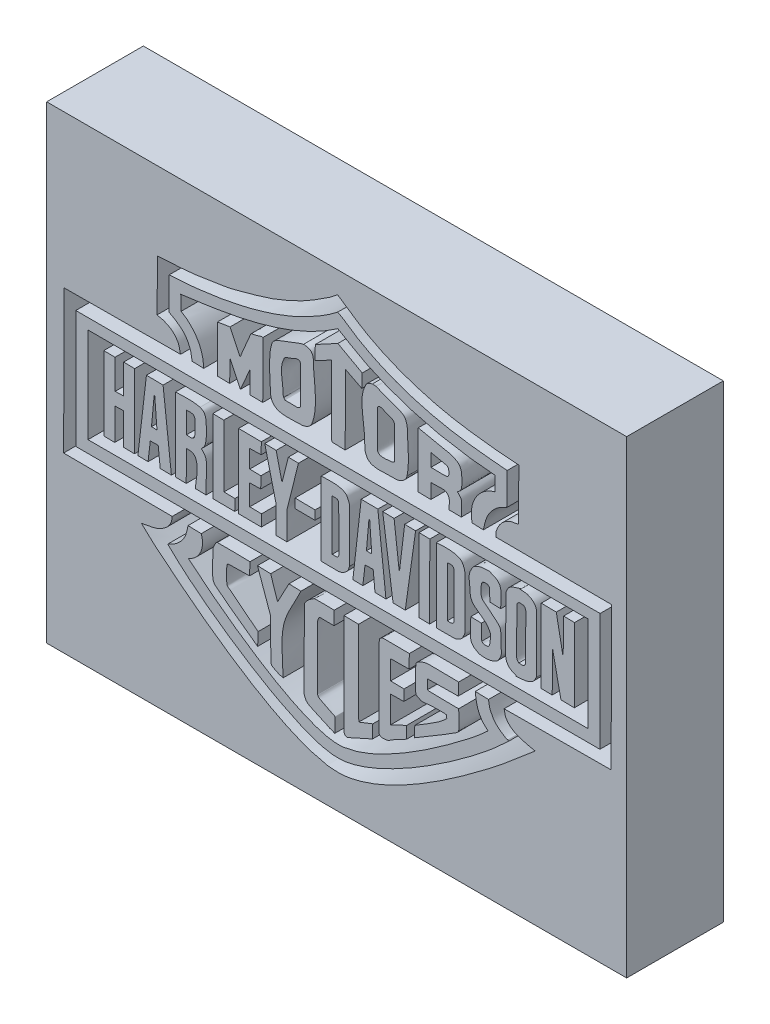
from build123d import *

# Parameters (mm, degrees)
SKETCH1_W              = 120
SKETCH1_H              = 97
BOSS_EXTRUDE2_DEPTH    = 20
BOSS_EXTRUDE2_2_DEPTH  = 20
BOSS_EXTRUDE2_3_DEPTH  = 20
BOSS_EXTRUDE2_4_DEPTH  = 20
BOSS_EXTRUDE2_5_DEPTH  = 20
BOSS_EXTRUDE2_6_DEPTH  = 20
BOSS_EXTRUDE2_7_DEPTH  = 20
BOSS_EXTRUDE2_8_DEPTH  = 20
BOSS_EXTRUDE2_9_DEPTH  = 20
BOSS_EXTRUDE2_10_DEPTH = 20
BOSS_EXTRUDE2_11_DEPTH = 20
BOSS_EXTRUDE2_12_DEPTH = 20
BOSS_EXTRUDE2_13_DEPTH = 20
BOSS_EXTRUDE2_14_DEPTH = 20
BOSS_EXTRUDE2_15_DEPTH = 20
BOSS_EXTRUDE2_16_DEPTH = 20
BOSS_EXTRUDE2_17_DEPTH = 20
BOSS_EXTRUDE2_18_DEPTH = 20
BOSS_EXTRUDE2_19_DEPTH = 20
BOSS_EXTRUDE2_20_DEPTH = 20
BOSS_EXTRUDE2_21_DEPTH = 20
BOSS_EXTRUDE2_22_DEPTH = 20
BOSS_EXTRUDE2_23_DEPTH = 20
BOSS_EXTRUDE2_24_DEPTH = 20
BOSS_EXTRUDE2_25_DEPTH = 20
BOSS_EXTRUDE2_26_DEPTH = 20
BOSS_EXTRUDE2_27_DEPTH = 20
BOSS_EXTRUDE2_28_DEPTH = 20
BOSS_EXTRUDE2_29_DEPTH = 20
BOSS_EXTRUDE2_30_DEPTH = 20


with BuildPart() as part:
    # Sketch1 → Boss-Extrude2 (new body)
    with BuildSketch(Plane.XY):
        with Locations((60, 48.5)):
            Rectangle(SKETCH1_W, SKETCH1_H)
        with BuildLine():
            Line((22.821847687, 70.218295714), (22.947847687, 80.844295714))
            add(Edge.make_bspline(
                [(22.947847687, 80.844295714), (25.958713345, 81.085733055), (29.004754552, 81.067077924), (31.977847687, 81.600295714), (34.553847687, 82.062295714), (37.197481362, 82.239758118), (39.705847687, 82.986295714), (42.015437995, 83.673673782), (44.368205474, 84.229130213), (46.635847687, 85.044295714), (48.659856628, 85.771880628), (50.641334523, 86.630094252), (52.557847687, 87.606295714), (54.387071023, 88.538034941), (56.123033864, 89.646201114), (57.849847687, 90.756295714), (58.674202593, 91.286238154), (59.417847687, 91.932295714), (60.201847687, 92.520295714)],
                knots=[0, 0, 0, 0, 1, 1, 1, 2, 2, 2, 3, 3, 3, 4, 4, 4, 5, 5, 5, 6, 6, 6, 6], degree=3))
            add(Edge.make_bspline(
                [(60.201847687, 92.520295714), (62.091847687, 91.274295714), (63.913753165, 89.918289483), (65.871847687, 88.782295714), (67.588599224, 87.786317723), (69.378432772, 86.91073921), (71.205847687, 86.136295714), (73.150735574, 85.312068133), (75.145498466, 84.597578594), (77.169847687, 83.994295714), (79.379400857, 83.335819604), (81.624352313, 82.784368968), (83.889847687, 82.356295714), (86.446202878, 81.873263483), (89.033439072, 81.562798837), (91.617847687, 81.264295714), (93.641334998, 81.030579854), (95.677847687, 80.928295714), (97.707847687, 80.760295714)],
                knots=[0, 0, 0, 0, 1, 1, 1, 2, 2, 2, 3, 3, 3, 4, 4, 4, 5, 5, 5, 6, 6, 6, 6], degree=3))
            Line((97.707847687, 80.760295714), (97.581847687, 70.092295714))
            add(Edge.make_bspline(
                [(97.581847687, 70.092295714), (96.951847687, 69.952295714), (96.279847687, 69.938295714), (95.691847687, 69.672295714), (95.079450307, 69.395258804), (94.499957374, 68.999054251), (94.053847687, 68.496295714), (93.596272926, 67.980616222), (93.287919226, 67.335819819), (93.045847687, 66.690295714), (92.902530814, 66.308117387), (92.961847687, 65.878295714), (92.919847687, 65.472295714)],
                knots=[0, 0, 0, 0, 1, 1, 1, 2, 2, 2, 3, 3, 3, 4, 4, 4, 4], degree=3))
            Line((92.919847687, 65.472295714), (116.901847687, 65.346295714))
            Line((116.901847687, 65.346295714), (116.775847687, 35.694295714))
            Line((116.775847687, 35.694295714), (94.641847687, 35.568295714))
            add(Edge.make_bspline(
                [(94.641847687, 35.568295714), (94.767847687, 35.092295714), (94.774160512, 34.567015543), (95.019847687, 34.140295714), (95.321521111, 33.616336608), (95.738569205, 33.137266384), (96.237847687, 32.796295714), (97.638091572, 31.840031597), (99.413871331, 31.573774246), (101.067847687, 31.200295714)],
                knots=[0, 0, 0, 0, 1, 1, 1, 2, 2, 2, 3, 3, 3, 3], degree=3))
            add(Edge.make_bspline(
                [(101.067847687, 31.200295714), (98.449847687, 29.002295714), (95.900603159, 26.719698902), (93.213847687, 24.606295714), (90.255995966, 22.279648083), (87.231767286, 20.034451405), (84.141847687, 17.886295714), (81.670629469, 16.168269951), (79.13564206, 14.537576244), (76.539847687, 13.014295714), (74.455149856, 11.790940101), (72.308989736, 10.666182755), (70.113847687, 9.654295714), (68.536467241, 8.927176103), (66.904840593, 8.307580657), (65.241847687, 7.806295714), (63.969501581, 7.422765548), (62.65889502, 7.132817816), (61.335847687, 7.008295714), (60.261776459, 6.907206657), (59.179319559, 7.08042212), (58.101847687, 7.134295714), (58.057631036, 7.136506547), (58.018645552, 7.164966868), (57.975847687, 7.176295714), (56.590558083, 7.542990021), (55.164239193, 7.777661521), (53.817847687, 8.268295714), (51.850522391, 8.98520239), (49.9267614, 9.832326835), (48.063847687, 10.788295714), (45.664541506, 12.019518623), (43.324254918, 13.371278204), (41.049847687, 14.820295714), (38.112073698, 16.691942046), (35.238901194, 18.668922746), (32.439847687, 20.742295714), (29.187701719, 23.151292727), (26.035005632, 25.693568118), (22.905847687, 28.260295714), (21.748855601, 29.209331706), (20.693847687, 30.276295714), (19.587847687, 31.284295714)],
                knots=[0, 0, 0, 0, 1, 1, 1, 2, 2, 2, 3, 3, 3, 4, 4, 4, 5, 5, 5, 6, 6, 6, 7, 7, 7, 8, 8, 8, 9, 9, 9, 10, 10, 10, 11, 11, 11, 12, 12, 12, 13, 13, 13, 14, 14, 14, 14], degree=3))
            add(Edge.make_bspline(
                [(19.587847687, 31.284295714), (20.637847687, 31.508295714), (21.725274203, 31.59940506), (22.737847687, 31.956295714), (23.45354083, 32.208548215), (24.128212435, 32.60530304), (24.711847687, 33.090295714), (25.14254842, 33.448201957), (25.475933567, 33.930206533), (25.719847687, 34.434295714), (25.906406115, 34.819849799), (25.887847687, 35.274295714), (25.971847687, 35.694295714)],
                knots=[0, 0, 0, 0, 1, 1, 1, 2, 2, 2, 3, 3, 3, 4, 4, 4, 4], degree=3))
            Line((25.971847687, 35.694295714), (3.501847687, 35.820295714))
            Line((3.501847687, 35.820295714), (3.627847687, 65.472295714))
            Line((3.627847687, 65.472295714), (27.693847687, 65.598295714))
            add(Edge.make_bspline(
                [(27.693847687, 65.598295714), (27.525847687, 66.214295714), (27.481060853, 66.878074902), (27.189847687, 67.446295714), (26.894671308, 68.022249623), (26.470196218, 68.54537836), (25.971847687, 68.958295714), (25.470244979, 69.373909386), (24.85467026, 69.640366685), (24.249847687, 69.882295714), (23.795823534, 70.063905375), (23.297847687, 70.106295714), (22.821847687, 70.218295714)],
                knots=[0, 0, 0, 0, 1, 1, 1, 2, 2, 2, 3, 3, 3, 4, 4, 4, 4], degree=3))
        make_face(mode=Mode.SUBTRACT)
    extrude(amount=BOSS_EXTRUDE2_DEPTH)


with BuildPart() as body_2:
    # Sketch1 → Boss-Extrude2 2 (new body)
    with BuildSketch(Plane.XY):
        with BuildLine():
            add(Edge.make_bspline(
                [(53.145847687, 80.130295714), (53.783091445, 80.092810787), (54.484230936, 80.030082516), (54.867847687, 79.416295714), (55.05436965, 79.117860573), (55.160542041, 78.852653917), (55.161847687, 78.492295714), (55.17529001, 74.782214407), (56.251086111, 70.882010987), (55.077847687, 67.362295714), (54.832999919, 66.627752412), (54.707587516, 66.212628565), (53.943847687, 65.808295714), (53.600926611, 65.626749262), (53.123015069, 65.472295714), (52.725847687, 65.472295714), (50.059155958, 65.472295714), (46.317896569, 64.586274897), (46.299847687, 68.286295714)],
                knots=[0, 0, 0, 0, 1, 1, 1, 2, 2, 2, 3, 3, 3, 4, 4, 4, 5, 5, 5, 6, 6, 6, 6], degree=3))
            add(Edge.make_bspline(
                [(46.299847687, 68.286295714), (46.290439131, 70.215049676), (45.715482787, 74.345201016), (46.593847687, 76.980295714), (46.876360602, 77.827834459), (47.828708242, 78.167683573), (48.567847687, 78.450295714), (49.66066626, 78.86813811), (50.751855085, 79.29029856), (51.843847687, 79.710295714), (52.108431, 79.812058527), (52.366833249, 79.935542105), (52.641847687, 80.004295714), (53.182684124, 80.139504823), (52.914383667, 80.014563704), (53.145847687, 80.130295714)],
                knots=[6, 6, 6, 6, 7, 7, 7, 8, 8, 8, 9, 9, 9, 10, 10, 10, 11, 11, 11, 11], degree=3))
        make_face()
        with BuildLine():
            add(Edge.make_bspline(
                [(49.029847687, 68.538295714), (48.963046165, 68.664476365), (48.946734456, 68.815525922), (48.945847687, 68.958295714), (48.932629406, 71.086438866), (48.078094778, 73.438789896), (49.029847687, 75.342295714), (49.077529969, 75.437660278), (49.090839823, 75.551785492), (49.155847687, 75.636295714), (49.234545263, 75.738602564), (49.341273734, 75.818498173), (49.449847687, 75.888295714), (49.703521231, 76.051371564), (50.009161676, 76.11402621), (50.289847687, 76.224295714), (50.797063987, 76.423559261), (51.314195706, 76.610469723), (51.801847687, 76.854295714)],
                knots=[6, 6, 6, 6, 7, 7, 7, 8, 8, 8, 9, 9, 9, 10, 10, 10, 11, 11, 11, 12, 12, 12, 12], degree=3))
            add(Edge.make_bspline(
                [(51.801847687, 76.854295714), (52.239984771, 76.810482006), (52.515847687, 76.764847312), (52.515847687, 76.224295714), (52.515847687, 73.69025704), (52.501692584, 71.156181398), (52.473847687, 68.622295714), (52.470568744, 68.323911972), (51.926873404, 68.16346277), (51.717847687, 68.160295714), (50.933812686, 68.148416396), (50.149490435, 68.174799477), (49.365847687, 68.202295714), (49.346060873, 68.202989988), (49.337847687, 68.230295714), (49.323847687, 68.244295714), (49.225847687, 68.342295714), (49.094693616, 68.415808958), (49.029847687, 68.538295714)],
                knots=[0, 0, 0, 0, 1, 1, 1, 2, 2, 2, 3, 3, 3, 4, 4, 4, 5, 5, 5, 6, 6, 6, 6], degree=3))
        make_face(mode=Mode.SUBTRACT)
    extrude(amount=BOSS_EXTRUDE2_2_DEPTH)


with BuildPart() as body_3:
    # Sketch1 → Boss-Extrude2 3 (new body)
    with BuildSketch(Plane.XY):
        Polygon((55.581847687, 81.306295714), (60.243847687, 83.826295714), (65.283847687, 81.054295714), (65.199847687, 78.240295714), (61.839847687, 79.962295714), (61.755847687, 65.472295714), (58.983847687, 65.556295714), (58.899847687, 80.172295714), (55.497847687, 78.366295714), align=None)
    extrude(amount=BOSS_EXTRUDE2_3_DEPTH)


with BuildPart() as body_4:
    # Sketch1 → Boss-Extrude2 4 (new body)
    with BuildSketch(Plane.XY):
        with BuildLine():
            add(Edge.make_bspline(
                [(67.383847687, 80.130295714), (67.635847687, 80.116295714), (67.888845858, 80.114716959), (68.139847687, 80.088295714), (68.15953789, 80.086223061), (68.163064716, 80.052556704), (68.181847687, 80.046295714), (68.90889186, 79.803947656), (69.613608485, 79.521464638), (70.323847687, 79.248295714), (71.054389264, 78.967318185), (71.782060152, 78.68046604), (72.507847687, 78.408295714), (73.190831832, 78.15217666), (73.950585981, 77.89790636), (74.271847687, 77.148295714), (74.448409681, 76.736317727), (74.599431918, 76.294435396), (74.607847687, 75.846295714), (74.659369119, 73.102779441), (75.145990362, 70.305009088), (74.607847687, 67.614295714), (74.582984987, 67.489982215), (74.590710387, 67.360609214), (74.565847687, 67.236295714)],
                knots=[0, 0, 0, 0, 1, 1, 1, 2, 2, 2, 3, 3, 3, 4, 4, 4, 5, 5, 5, 6, 6, 6, 7, 7, 7, 8, 8, 8, 8], degree=3))
            add(Edge.make_bspline(
                [(74.565847687, 67.236295714), (74.378712654, 66.30062055), (73.352916389, 65.570039836), (72.423847687, 65.514295714), (71.864678315, 65.480745552), (71.304022659, 65.472295714), (70.743847687, 65.472295714), (69.680912458, 65.472295714), (67.060251511, 65.039577804), (66.249847687, 66.480295714), (66.020564867, 66.887909615), (65.857115007, 67.267662157), (65.829847687, 67.740295714), (65.797583549, 68.299540764), (65.787847687, 68.860120741), (65.787847687, 69.420295714), (65.787847687, 72.59841906), (64.450547718, 76.111695777), (65.871847687, 78.954295714), (66.057636251, 79.325872843), (66.067708088, 79.512726515), (66.417847687, 79.752295714), (66.748074319, 79.978240252), (67.02936295, 80.012134135), (67.383847687, 80.130295714)],
                knots=[8, 8, 8, 8, 9, 9, 9, 10, 10, 10, 11, 11, 11, 12, 12, 12, 13, 13, 13, 14, 14, 14, 15, 15, 15, 16, 16, 16, 16], degree=3))
        make_face()
        with BuildLine():
            add(Edge.make_bspline(
                [(71.961847687, 68.580295714), (71.960780676, 68.498669361), (71.899592605, 68.421291649), (71.835847687, 68.370295714), (71.693277913, 68.256239895), (71.440016967, 68.160295714), (71.247847687, 68.160295714), (70.547106077, 68.160295714), (68.433847687, 67.616013913), (68.433847687, 69.000295714), (68.433847687, 71.50633482), (68.448004526, 74.012411288), (68.475847687, 76.518295714), (68.476690873, 76.594182503), (68.739244915, 76.796994328), (68.853847687, 76.854295714)],
                knots=[5, 5, 5, 5, 6, 6, 6, 7, 7, 7, 8, 8, 8, 9, 9, 9, 10, 10, 10, 10], degree=3))
            add(Edge.make_bspline(
                [(68.853847687, 76.854295714), (69.009595643, 76.838720918), (69.171112671, 76.829892485), (69.315847687, 76.770295714), (69.537060375, 76.679208137), (69.764747458, 76.604657093), (69.987847687, 76.518295714), (70.198773069, 76.436647179), (70.407847687, 76.350295714), (70.617847687, 76.266295714), (71.278077078, 76.002203958), (71.998554013, 75.821870804), (72.003847687, 74.964295714), (72.016983523, 72.836290204), (71.989662906, 70.708159975), (71.961847687, 68.580295714)],
                knots=[0, 0, 0, 0, 1, 1, 1, 2, 2, 2, 3, 3, 3, 4, 4, 4, 5, 5, 5, 5], degree=3))
        make_face(mode=Mode.SUBTRACT)
    extrude(amount=BOSS_EXTRUDE2_4_DEPTH)


with BuildPart() as body_5:
    # Sketch1 → Boss-Extrude2 5 (new body)
    with BuildSketch(Plane.XY):
        with BuildLine():
            add(Edge.make_bspline(
                [(83.217847687, 65.514295714), (83.205564835, 66.202135428), (83.638345602, 67.687422277), (82.839847687, 68.286295714), (82.630478141, 68.443322873), (82.310391466, 68.580295714), (82.041847687, 68.580295714), (81.201731028, 68.580295714), (80.361847687, 68.552295714), (79.521847687, 68.538295714)],
                knots=[0, 0, 0, 0, 1, 1, 1, 2, 2, 2, 3, 3, 3, 3], degree=3))
            Line((79.521847687, 68.538295714), (79.479847687, 65.472295714))
            Line((79.479847687, 65.472295714), (76.875847687, 65.514295714))
            Line((76.875847687, 65.514295714), (76.875847687, 77.022295714))
            add(Edge.make_bspline(
                [(76.875847687, 77.022295714), (78.435052729, 76.729944769), (79.959716938, 76.376322953), (81.495847687, 76.056295714), (82.342206683, 75.879970923), (83.225236346, 75.797717106), (84.015847687, 75.468295714), (84.570942719, 75.237006117), (85.16441518, 74.980802601), (85.485847687, 74.418295714), (85.648448094, 74.133745002), (85.813952831, 73.821932207), (85.821847687, 73.494295714), (85.8263431, 73.307736083), (86.196566007, 70.802603824), (85.527847687, 70.050295714), (85.375298407, 69.878677774), (85.168694784, 69.763757927), (84.981847687, 69.630295714)],
                knots=[0, 0, 0, 0, 1, 1, 1, 2, 2, 2, 3, 3, 3, 4, 4, 4, 5, 5, 5, 6, 6, 6, 6], degree=3))
            add(Edge.make_bspline(
                [(84.981847687, 69.630295714), (85.284196724, 69.327946676), (85.809543416, 68.850162273), (85.821847687, 68.370295714), (85.846611379, 67.404511701), (85.793847687, 66.438295714), (85.779847687, 65.472295714)],
                knots=[0, 0, 0, 0, 1, 1, 1, 2, 2, 2, 2], degree=3))
            Line((85.779847687, 65.472295714), (83.217847687, 65.514295714))
        make_face()
        with BuildLine():
            Line((79.521847687, 71.268295714), (79.521847687, 73.914295714))
            add(Edge.make_bspline(
                [(79.521847687, 73.914295714), (80.670421558, 73.68458094), (81.691346579, 73.482839433), (82.797847687, 73.242295714), (82.817194792, 73.238089822), (82.825847687, 73.214295714), (82.839847687, 73.200295714), (82.923847687, 73.116295714), (83.032909388, 73.051437737), (83.091847687, 72.948295714), (83.219713996, 72.724529673), (83.312341402, 71.740789429), (83.091847687, 71.520295714), (83.007847687, 71.436295714), (82.957289613, 71.286167312), (82.839847687, 71.268295714), (82.286048157, 71.184021873), (81.720022659, 71.226295714), (81.159847687, 71.226295714), (80.613668229, 71.226295714), (80.067847687, 71.254295714), (79.521847687, 71.268295714)],
                knots=[0, 0, 0, 0, 1, 1, 1, 2, 2, 2, 3, 3, 3, 4, 4, 4, 5, 5, 5, 6, 6, 6, 7, 7, 7, 7], degree=3))
        make_face(mode=Mode.SUBTRACT)
    extrude(amount=BOSS_EXTRUDE2_5_DEPTH)


with BuildPart() as body_6:
    # Sketch1 → Boss-Extrude2 6 (new body)
    with BuildSketch(Plane.XY):
        Polygon((11.817847687, 43.044295714), (11.817847687, 58.332295714), (14.127847687, 58.290295714), (14.169847687, 52.200295714), (15.891847687, 52.242295714), (15.933847687, 58.332295714), (18.201847687, 58.290295714), (18.159847687, 43.002295714), (15.891847687, 43.044295714), (15.849847687, 49.596295714), (14.127847687, 49.554295714), (14.085847687, 43.002295714), align=None)
    extrude(amount=BOSS_EXTRUDE2_6_DEPTH)


with BuildPart() as body_7:
    # Sketch1 → Boss-Extrude2 7 (new body)
    with BuildSketch(Plane.XY):
        Polygon((18.873847687, 43.044295714), (20.637847687, 58.332295714), (24.081847687, 58.290295714), (25.803847687, 43.002295714), (23.493847687, 43.044295714), (23.073847687, 46.992295714), (21.435847687, 46.950295714), (20.973847687, 43.002295714), align=None)
        Polygon((22.821847687, 49.596295714), (21.687847687, 49.638295714), (22.233847687, 55.518295714), (22.359847687, 55.476295714), align=None, mode=Mode.SUBTRACT)
    extrude(amount=BOSS_EXTRUDE2_7_DEPTH)


with BuildPart() as body_8:
    # Sketch1 → Boss-Extrude2 8 (new body)
    with BuildSketch(Plane.XY):
        with BuildLine():
            add(Edge.make_bspline(
                [(47.475847687, 43.044295714), (47.461847687, 45.004295714), (47.461647018, 46.964442863), (47.433847687, 48.924295714), (47.433566878, 48.944092713), (47.396580022, 48.9470706), (47.391847687, 48.966295714), (47.171883144, 49.859901668), (46.975373591, 50.759129423), (46.761847687, 51.654295714), (46.230119724, 53.883462944), (45.679667137, 56.109017913), (45.123847687, 58.332295714)],
                knots=[0, 0, 0, 0, 1, 1, 1, 2, 2, 2, 3, 3, 3, 4, 4, 4, 4], degree=3))
            Line((45.123847687, 58.332295714), (47.475847687, 58.290295714))
            Line((47.475847687, 58.290295714), (48.693847687, 53.124295714))
            Line((48.693847687, 53.124295714), (49.995847687, 58.332295714))
            Line((49.995847687, 58.332295714), (52.095847687, 58.290295714))
            add(Edge.make_bspline(
                [(52.095847687, 58.290295714), (51.765244255, 56.857680842), (51.398578168, 55.43362371), (51.045847687, 54.006295714), (50.751771857, 52.816314451), (50.456695362, 51.626579814), (50.163847687, 50.436295714), (50.02269494, 49.862578099), (49.780495018, 49.303984592), (49.743847687, 48.714295714), (49.625744656, 46.813910576), (49.715847687, 44.906295714), (49.701847687, 43.002295714)],
                knots=[0, 0, 0, 0, 1, 1, 1, 2, 2, 2, 3, 3, 3, 4, 4, 4, 4], degree=3))
            Line((49.701847687, 43.002295714), (47.475847687, 43.044295714))
        make_face()
    extrude(amount=BOSS_EXTRUDE2_8_DEPTH)


with BuildPart() as body_9:
    # Sketch1 → Boss-Extrude2 9 (new body)
    with BuildSketch(Plane.XY):
        Polygon((6.021847687, 38.256295714), (6.021847687, 62.616295714), (114.507847687, 62.574295714), (114.465847687, 38.214295714), align=None)
        Polygon((111.987847687, 40.692295714), (8.541847687, 40.734295714), (8.541847687, 60.390295714), (112.029847687, 60.348295714), align=None, mode=Mode.SUBTRACT)
    extrude(amount=BOSS_EXTRUDE2_9_DEPTH)


with BuildPart() as body_10:
    # Sketch1 → Boss-Extrude2 10 (new body)
    with BuildSketch(Plane.XY):
        with BuildLine():
            add(Edge.make_bspline(
                [(56.799847687, 58.332295714), (57.518421445, 58.323741265), (61.342946302, 58.823518207), (62.175847687, 57.324295714), (62.434466107, 56.858782558), (62.677713308, 56.278965431), (62.679847687, 55.728295714), (62.693522003, 52.200322215), (62.693792242, 48.672268156), (62.679847687, 45.144295714), (62.67976943, 45.124496879), (62.644108677, 45.121078685), (62.637847687, 45.102295714), (62.573386846, 44.908913192), (62.534308528, 44.707678237), (62.469847687, 44.514295714), (62.206213789, 43.723394022), (61.090147415, 43.044295714), (60.285847687, 43.044295714), (59.123763352, 43.044295714), (57.961847687, 43.072295714), (56.799847687, 43.086295714)],
                knots=[0, 0, 0, 0, 1, 1, 1, 2, 2, 2, 3, 3, 3, 4, 4, 4, 5, 5, 5, 6, 6, 6, 7, 7, 7, 7], degree=3))
            Line((56.799847687, 43.086295714), (56.799847687, 58.332295714))
        make_face()
        with BuildLine():
            Line((59.067847687, 45.438295714), (59.067847687, 55.938295714))
            add(Edge.make_bspline(
                [(59.067847687, 55.938295714), (59.095187593, 55.937052991), (60.075968611, 55.975481251), (60.243847687, 55.770295714), (60.331161052, 55.663579379), (60.408863883, 55.530147435), (60.411847687, 55.392295714), (60.479105343, 52.284991994), (60.453847687, 49.176327245), (60.453847687, 46.068295714), (60.453847687, 45.910365163), (60.281630675, 45.496758353), (60.075847687, 45.480295714), (59.740627141, 45.45347807), (59.403847687, 45.452295714), (59.067847687, 45.438295714)],
                knots=[0, 0, 0, 0, 1, 1, 1, 2, 2, 2, 3, 3, 3, 4, 4, 4, 5, 5, 5, 5], degree=3))
        make_face(mode=Mode.SUBTRACT)
    extrude(amount=BOSS_EXTRUDE2_10_DEPTH)


with BuildPart() as body_11:
    # Sketch1 → Boss-Extrude2 11 (new body)
    with BuildSketch(Plane.XY):
        Polygon((63.351847687, 43.044295714), (65.073847687, 58.332295714), (68.517847687, 58.290295714), (70.197847687, 43.002295714), (67.929847687, 43.044295714), (67.551847687, 46.992295714), (65.871847687, 46.950295714), (65.409847687, 43.002295714), align=None)
        Polygon((67.257847687, 49.596295714), (66.165847687, 49.638295714), (66.669847687, 55.518295714), (66.837847687, 55.476295714), align=None, mode=Mode.SUBTRACT)
    extrude(amount=BOSS_EXTRUDE2_11_DEPTH)


with BuildPart() as body_12:
    # Sketch1 → Boss-Extrude2 12 (new body)
    with BuildSketch(Plane.XY):
        Polygon((39.705847687, 43.044295714), (39.705847687, 58.332295714), (44.409847687, 58.290295714), (44.367847687, 55.938295714), (41.973847687, 55.896295714), (42.015847687, 52.200295714), (44.325847687, 52.158295714), (44.283847687, 49.764295714), (41.973847687, 49.722295714), (42.015847687, 45.438295714), (44.451847687, 45.396295714), (44.409847687, 43.002295714), align=None)
    extrude(amount=BOSS_EXTRUDE2_12_DEPTH)


with BuildPart() as body_13:
    # Sketch1 → Boss-Extrude2 13 (new body)
    with BuildSketch(Plane.XY):
        Polygon((34.371847687, 43.086295714), (34.371847687, 58.332295714), (36.639847687, 58.290295714), (36.681847687, 45.438295714), (38.949847687, 45.396295714), (38.907847687, 43.044295714), align=None)
    extrude(amount=BOSS_EXTRUDE2_13_DEPTH)


with BuildPart() as body_14:
    # Sketch1 → Boss-Extrude2 14 (new body)
    with BuildSketch(Plane.XY):
        Polygon((71.667847687, 43.044295714), (69.525847687, 58.332295714), (71.877847687, 58.290295714), (72.927847687, 49.470295714), (73.011847687, 49.512295714), (74.061847687, 58.332295714), (76.329847687, 58.290295714), (74.187847687, 43.002295714), align=None)
    extrude(amount=BOSS_EXTRUDE2_14_DEPTH)


with BuildPart() as body_15:
    # Sketch1 → Boss-Extrude2 15 (new body)
    with BuildSketch(Plane.XY):
        with BuildLine():
            add(Edge.make_bspline(
                [(30.759847687, 43.086295714), (30.75299044, 44.005166782), (31.93366107, 48.541865695), (30.129847687, 49.218295714), (29.74609891, 49.362201505), (29.319845406, 49.347438788), (28.911847687, 49.386295714)],
                knots=[0, 0, 0, 0, 1, 1, 1, 2, 2, 2, 2], degree=3))
            Line((28.911847687, 49.386295714), (28.869847687, 43.044295714))
            Line((28.869847687, 43.044295714), (26.643847687, 43.086295714))
            Line((26.643847687, 43.086295714), (26.643847687, 58.332295714))
            add(Edge.make_bspline(
                [(26.643847687, 58.332295714), (28.142042678, 58.318161799), (29.672843819, 58.562225114), (31.137847687, 58.248295714), (31.317901446, 58.209712766), (31.503793928, 58.202878662), (31.683847687, 58.164295714), (31.703207187, 58.16014725), (31.708138932, 58.131150092), (31.725847687, 58.122295714), (31.877151355, 58.04664388), (32.036544019, 57.987947548), (32.187847687, 57.912295714), (32.681488153, 57.665475481), (32.968865061, 56.778113616), (32.985847687, 56.274295714), (33.022635782, 55.182915562), (33.130170469, 54.080716582), (32.985847687, 52.998295714), (32.834064605, 51.859922605), (32.839732127, 51.758168599), (32.019847687, 50.856295714)],
                knots=[0, 0, 0, 0, 1, 1, 1, 2, 2, 2, 3, 3, 3, 4, 4, 4, 5, 5, 5, 6, 6, 6, 7, 7, 7, 7], degree=3))
            add(Edge.make_bspline(
                [(32.019847687, 50.856295714), (32.540767685, 50.291965716), (33.022497445, 49.79558322), (33.027847687, 48.966295714), (33.040583226, 46.992287151), (32.999847687, 45.018295714), (32.985847687, 43.044295714)],
                knots=[0, 0, 0, 0, 1, 1, 1, 2, 2, 2, 2], degree=3))
            Line((32.985847687, 43.044295714), (30.759847687, 43.086295714))
        make_face()
        with BuildLine():
            Line((28.911847687, 51.780295714), (28.911847687, 56.232295714))
            add(Edge.make_bspline(
                [(28.911847687, 56.232295714), (29.615833882, 56.208829508), (30.662697783, 56.43113809), (30.675847687, 55.392295714), (30.688430205, 54.39827676), (30.661450889, 53.404010997), (30.633847687, 52.410295714), (30.626218055, 52.135628955), (30.226949935, 51.754864605), (29.961847687, 51.738295714), (29.612249941, 51.716445855), (29.261847687, 51.766295714), (28.911847687, 51.780295714)],
                knots=[0, 0, 0, 0, 1, 1, 1, 2, 2, 2, 3, 3, 3, 4, 4, 4, 4], degree=3))
        make_face(mode=Mode.SUBTRACT)
    extrude(amount=BOSS_EXTRUDE2_15_DEPTH)


with BuildPart() as body_16:
    # Sketch1 → Boss-Extrude2 16 (new body)
    with BuildSketch(Plane.XY):
        Polygon((77.001847687, 43.086295714), (77.043847687, 58.332295714), (79.269847687, 58.290295714), (79.227847687, 43.044295714), align=None)
    extrude(amount=BOSS_EXTRUDE2_16_DEPTH)


with BuildPart() as body_17:
    # Sketch1 → Boss-Extrude2 17 (new body)
    with BuildSketch(Plane.XY):
        with BuildLine():
            add(Edge.make_bspline(
                [(80.613847687, 58.332295714), (81.144137516, 58.326269693), (85.205453625, 58.853805025), (86.031847687, 57.366295714), (86.290458473, 56.900796298), (86.533729762, 56.320956183), (86.535847687, 55.770295714), (86.549524509, 52.214322016), (86.549792678, 48.658268371), (86.535847687, 45.102295714), (86.535417606, 44.992625232), (86.431753812, 44.768107964), (86.367847687, 44.640295714), (86.292195853, 44.488992046), (86.233499521, 44.329599382), (86.157847687, 44.178295714), (85.846763007, 43.556126355), (84.957680973, 43.058519081), (84.267847687, 43.044295714), (83.050106505, 43.019187648), (81.831847687, 43.044295714), (80.613847687, 43.044295714)],
                knots=[0, 0, 0, 0, 1, 1, 1, 2, 2, 2, 3, 3, 3, 4, 4, 4, 5, 5, 5, 6, 6, 6, 7, 7, 7, 7], degree=3))
            Line((80.613847687, 43.044295714), (80.613847687, 58.332295714))
        make_face()
        with BuildLine():
            Line((82.923847687, 45.480295714), (82.923847687, 55.896295714))
            add(Edge.make_bspline(
                [(82.923847687, 55.896295714), (83.364220351, 55.877149076), (83.938866441, 56.050258206), (84.183847687, 55.560295714), (84.285769225, 55.356452637), (84.309847687, 55.116199202), (84.309847687, 54.888295714), (84.309847687, 51.920262695), (84.295715313, 48.952197902), (84.267847687, 45.984295714), (84.266558733, 45.847022121), (84.084116716, 45.585741143), (83.931847687, 45.522295714), (83.57071555, 45.37182399), (83.33663436, 45.454496547), (82.923847687, 45.480295714)],
                knots=[0, 0, 0, 0, 1, 1, 1, 2, 2, 2, 3, 3, 3, 4, 4, 4, 5, 5, 5, 5], degree=3))
        make_face(mode=Mode.SUBTRACT)
    extrude(amount=BOSS_EXTRUDE2_17_DEPTH)


with BuildPart() as body_18:
    # Sketch1 → Boss-Extrude2 18 (new body)
    with BuildSketch(Plane.XY):
        with BuildLine():
            add(Edge.make_bspline(
                [(25.047847687, 30.276295714), (25.565847687, 30.556295714), (26.118770383, 30.779605472), (26.601847687, 31.116295714), (27.049195694, 31.428083719), (27.461306375, 31.797467127), (27.819847687, 32.208295714), (28.139000478, 32.57399162), (28.414029135, 32.98578465), (28.617847687, 33.426295714), (28.947324947, 34.138391729), (29.103250341, 34.923109869), (29.247847687, 35.694295714)],
                knots=[0, 0, 0, 0, 1, 1, 1, 2, 2, 2, 3, 3, 3, 4, 4, 4, 4], degree=3))
            Line((29.247847687, 35.694295714), (31.977847687, 35.610295714))
            ThreePointArc((31.977847687, 35.610295714), (31.825540106, 32.176592686), (29.289847687, 29.856295714))
            add(Edge.make_bspline(
                [(29.289847687, 29.856295714), (30.885847687, 28.554295714), (32.446468581, 27.207682772), (34.077847687, 25.950295714), (35.989623806, 24.476792381), (37.93500122, 23.045551772), (39.915847687, 21.666295714), (41.716283067, 20.412659227), (43.551796116, 19.207995648), (45.417847687, 18.054295714), (46.927338284, 17.121042191), (48.466224078, 16.232627705), (50.037847687, 15.408295714), (51.324621728, 14.733370114), (52.642924766, 14.115156083), (53.985847687, 13.560295714), (54.984254024, 13.147780521), (56.010194396, 12.79655158), (57.051847687, 12.510295714), (57.848777669, 12.291292055), (58.664767407, 12.123121194), (59.487847687, 12.048295714), (60.241259163, 11.979803762), (61.020019948, 11.956575657), (61.755847687, 12.132295714), (62.693847687, 12.356295714), (63.673016403, 12.449734509), (64.569847687, 12.804295714), (65.831861606, 13.30323145), (67.146514163, 13.688916697), (68.349847687, 14.316295714), (69.904584111, 15.12688479), (71.493320892, 15.875747727), (73.011847687, 16.752295714), (74.939715809, 17.865130159), (76.831689673, 19.042559343), (78.681847687, 20.280295714), (80.85155699, 21.731808558), (82.976577345, 23.251215064), (85.065847687, 24.816295714), (87.223611604, 26.432685172), (89.373648407, 28.078741856), (91.323847687, 29.940295714)],
                knots=[0, 0, 0, 0, 1, 1, 1, 2, 2, 2, 3, 3, 3, 4, 4, 4, 5, 5, 5, 6, 6, 6, 7, 7, 7, 8, 8, 8, 9, 9, 9, 10, 10, 10, 11, 11, 11, 12, 12, 12, 13, 13, 13, 14, 14, 14, 14], degree=3))
            add(Edge.make_bspline(
                [(91.323847687, 29.940295714), (90.931847687, 30.318295714), (90.477875919, 30.641133659), (90.147847687, 31.074295714), (89.798430266, 31.532906078), (89.521974945, 32.050977568), (89.307847687, 32.586295714), (88.915261917, 33.567760137), (88.783030037, 34.642472215), (88.677847687, 35.694295714)],
                knots=[0, 0, 0, 0, 1, 1, 1, 2, 2, 2, 3, 3, 3, 3], degree=3))
            Line((88.677847687, 35.694295714), (91.407847687, 35.610295714))
            add(Edge.make_bspline(
                [(91.407847687, 35.610295714), (91.551515791, 34.955807681), (91.549431082, 34.293672796), (91.869847687, 33.720295714), (92.105341647, 33.298885469), (92.283871683, 32.838526328), (92.583847687, 32.460295714), (92.934536789, 32.018122498), (93.348004414, 31.61974509), (93.801847687, 31.284295714), (95.897446677, 29.735374721), (95.094468859, 30.899363956), (95.565847687, 30.192295714)],
                knots=[0, 0, 0, 0, 1, 1, 1, 2, 2, 2, 3, 3, 3, 4, 4, 4, 4], degree=3))
            add(Edge.make_bspline(
                [(95.565847687, 30.192295714), (94.389847687, 29.128295714), (93.253144159, 28.019180636), (92.037847687, 27.000295714), (90.479604917, 25.69389016), (88.879788267, 24.436071065), (87.249847687, 23.220295714), (85.462617108, 21.887197496), (83.642858787, 20.596333561), (81.789847687, 19.356295714), (79.95958731, 18.131482686), (78.099404944, 16.949403508), (76.203847687, 15.828295714), (73.234489178, 14.072099242), (70.164314196, 12.454057386), (66.963847687, 11.166295714), (65.961661888, 10.763049357), (64.938595317, 10.40582701), (63.897847687, 10.116295714), (63.072553216, 9.886702515), (62.23008743, 9.698964163), (61.377847687, 9.612295714), (60.570014191, 9.530143155), (59.753734932, 9.59876426), (58.941847687, 9.612295714), (58.910547082, 9.612817391), (58.888429495, 9.647605944), (58.857847687, 9.654295714), (57.961847687, 9.850295714), (57.029822048, 9.923428816), (56.169847687, 10.242295714), (54.894664364, 10.715116497), (53.568260796, 11.070092546), (52.347847687, 11.670295714), (50.696029424, 12.482665351), (49.010084923, 13.228938177), (47.391847687, 14.106295714), (45.5216747, 15.120244924), (43.69008549, 16.206812653), (41.889847687, 17.340295714), (39.908484252, 18.58782084), (37.961377079, 19.891372285), (36.051847687, 21.246295714), (32.176166326, 23.996319621), (28.411047706, 26.913095695), (25.047847687, 30.276295714)],
                knots=[0, 0, 0, 0, 1, 1, 1, 2, 2, 2, 3, 3, 3, 4, 4, 4, 5, 5, 5, 6, 6, 6, 7, 7, 7, 8, 8, 8, 9, 9, 9, 10, 10, 10, 11, 11, 11, 12, 12, 12, 13, 13, 13, 14, 14, 14, 15, 15, 15, 15], degree=3))
        make_face()
    extrude(amount=BOSS_EXTRUDE2_18_DEPTH)


with BuildPart() as body_19:
    # Sketch1 → Boss-Extrude2 19 (new body)
    with BuildSketch(Plane.XY):
        with BuildLine():
            add(Edge.make_bspline(
                [(90.021847687, 45.354295714), (90.175847687, 45.242295714), (90.298103638, 45.060237919), (90.483847687, 45.018295714), (90.757312359, 44.956545627), (91.043847687, 45.046295714), (91.323847687, 45.060295714)],
                knots=[0, 0, 0, 0, 1, 1, 1, 2, 2, 2, 2], degree=3))
            add(Edge.make_bspline(
                [(91.323847687, 45.060295714), (91.435847687, 45.242295714), (91.638880259, 45.393626095), (91.659847687, 45.606295714), (91.742310771, 46.442707), (92.05580828, 47.436352362), (91.575847687, 48.126295714), (91.369523423, 48.422886844), (91.213677068, 48.765801544), (90.945847687, 49.008295714), (90.169424034, 49.711273886), (89.238649617, 50.231157939), (88.467847687, 50.940295714), (88.179178806, 51.205871084), (87.949435169, 51.545365132), (87.795847687, 51.906295714), (87.66247041, 52.219732314), (87.633620327, 52.57370993), (87.627847687, 52.914295714), (87.605060178, 54.258758703), (87.069781719, 55.788645615), (87.753847687, 56.946295714), (87.919964751, 57.2274169), (88.020453678, 57.562090262), (88.257847687, 57.786295714), (88.540647393, 58.053384325), (88.905703664, 58.227298154), (89.265847687, 58.374295714), (89.599096254, 58.510315537), (89.956291558, 58.609700816), (90.315847687, 58.626295714), (91.977929193, 58.703007168), (91.496300793, 58.740008008), (92.079847687, 58.458295714), (92.457658883, 58.275904102), (92.887767757, 58.176265181), (93.213847687, 57.912295714), (93.494664441, 57.684967866), (93.725876683, 57.371790725), (93.843847687, 57.030295714), (94.000343227, 56.577282308), (94.001542912, 56.08146772), (94.011847687, 55.602295714), (94.029617222, 54.776012322), (93.955847687, 53.950295714), (93.927847687, 53.124295714)],
                knots=[0, 0, 0, 0, 1, 1, 1, 2, 2, 2, 3, 3, 3, 4, 4, 4, 5, 5, 5, 6, 6, 6, 7, 7, 7, 8, 8, 8, 9, 9, 9, 10, 10, 10, 11, 11, 11, 12, 12, 12, 13, 13, 13, 14, 14, 14, 15, 15, 15, 15], degree=3))
            Line((93.927847687, 53.124295714), (91.701847687, 53.208295714))
            Line((91.701847687, 53.208295714), (91.617847687, 55.812295714))
            add(Edge.make_bspline(
                [(91.617847687, 55.812295714), (91.463847687, 55.924295714), (91.341869562, 56.107603429), (91.155847687, 56.148295714), (90.868313633, 56.211193788), (90.567847687, 56.120295714), (90.273847687, 56.106295714)],
                knots=[0, 0, 0, 0, 1, 1, 1, 2, 2, 2, 2], degree=3))
            add(Edge.make_bspline(
                [(90.273847687, 56.106295714), (90.161847687, 55.924295714), (89.959730651, 55.772873079), (89.937847687, 55.560295714), (89.85898662, 54.794216781), (89.70394844, 53.969305871), (89.979847687, 53.250295714), (90.203305893, 52.667950086), (90.8599285, 52.365235743), (91.323847687, 51.948295714), (91.966487408, 51.370733433), (92.686879602, 50.879263798), (93.297847687, 50.268295714), (93.547699643, 50.018443758), (93.816551222, 49.732778037), (93.885847687, 49.386295714), (94.04793266, 48.575870849), (93.969847687, 47.734770154), (93.969847687, 46.908295714), (93.969847687, 46.06724637), (94.289602948, 45.101504132), (93.843847687, 44.388295714), (93.650358146, 44.078712449), (93.530594875, 43.704699504), (93.255847687, 43.464295714), (92.949575785, 43.1963078), (92.55417322, 43.03347374), (92.163847687, 42.918295714), (91.689110104, 42.778209214), (91.188771934, 42.701225368), (90.693847687, 42.708295714), (90.166712703, 42.715826214), (89.584616549, 42.719260983), (89.139847687, 43.002295714), (88.858105168, 43.181586408), (88.532327045, 43.308551376), (88.299847687, 43.548295714), (88.072532885, 43.782714103), (87.89512693, 44.077220752), (87.795847687, 44.388295714), (87.68021325, 44.750616949), (87.673613108, 45.141988179), (87.669847687, 45.522295714), (87.659587018, 46.558623229), (87.725847687, 47.594295714), (87.753847687, 48.630295714)],
                knots=[0, 0, 0, 0, 1, 1, 1, 2, 2, 2, 3, 3, 3, 4, 4, 4, 5, 5, 5, 6, 6, 6, 7, 7, 7, 8, 8, 8, 9, 9, 9, 10, 10, 10, 11, 11, 11, 12, 12, 12, 13, 13, 13, 14, 14, 14, 15, 15, 15, 15], degree=3))
            Line((87.753847687, 48.630295714), (89.937847687, 48.546295714))
            Line((89.937847687, 48.546295714), (90.021847687, 45.354295714))
        make_face()
    extrude(amount=BOSS_EXTRUDE2_19_DEPTH)


with BuildPart() as body_20:
    # Sketch1 → Boss-Extrude2 20 (new body)
    with BuildSketch(Plane.XY):
        with BuildLine():
            add(Edge.make_bspline(
                [(97.917847687, 58.626295714), (98.995219463, 58.491624242), (99.128221384, 58.664290444), (99.681847687, 58.374295714), (99.948122222, 58.234818577), (100.239373489, 58.134651363), (100.479847687, 57.954295714), (100.693823386, 57.793813939), (100.884089069, 57.593109502), (101.025847687, 57.366295714), (101.169151403, 57.137009768), (101.313643765, 56.880609442), (101.319847687, 56.610295714), (101.412039803, 52.593353517), (101.347462155, 48.57420082), (101.319847687, 44.556295714), (101.319417388, 44.493687289), (101.26769918, 44.442198241), (101.235847687, 44.388295714), (101.085604494, 44.134038004), (100.985865442, 43.837888689), (100.773847687, 43.632295714), (100.51175996, 43.37815004), (100.186440612, 43.185664743), (99.849847687, 43.044295714), (99.477307585, 42.887828871), (99.0767575, 42.780819185), (98.673847687, 42.750295714)],
                knots=[0, 0, 0, 0, 1, 1, 1, 2, 2, 2, 3, 3, 3, 4, 4, 4, 5, 5, 5, 6, 6, 6, 7, 7, 7, 8, 8, 8, 9, 9, 9, 9], degree=3))
            add(Edge.make_bspline(
                [(98.673847687, 42.750295714), (95.994551276, 42.547318713), (97.616161804, 42.613008972), (96.993847687, 42.876295714), (96.658615607, 43.018124671), (96.287548604, 43.092647595), (95.985847687, 43.296295714), (95.714952347, 43.479150068), (95.473135172, 43.724905636), (95.313847687, 44.010295714), (95.128238586, 44.342845352), (94.985362825, 44.721528695), (94.977847687, 45.102295714), (94.901044867, 48.993638583), (95.020149001, 52.886418375), (95.061847687, 56.778295714), (95.062183078, 56.809598869), (95.088074029, 56.835255157), (95.103847687, 56.862295714), (95.284109615, 57.171316162), (95.390135134, 57.540252243), (95.649847687, 57.786295714), (95.94105879, 58.062179917), (96.323067794, 58.236626138), (96.699847687, 58.374295714), (99.423834276, 59.369598506), (97.363035446, 58.348889594), (97.917847687, 58.626295714)],
                knots=[9, 9, 9, 9, 10, 10, 10, 11, 11, 11, 12, 12, 12, 13, 13, 13, 14, 14, 14, 15, 15, 15, 16, 16, 16, 17, 17, 17, 18, 18, 18, 18], degree=3))
        make_face()
        with BuildLine():
            add(Edge.make_bspline(
                [(97.707847687, 45.312295714), (97.456483247, 45.345810973), (97.246563654, 45.899327373), (97.245847687, 46.068295714), (97.232322254, 49.26029776), (97.259970752, 52.452386743), (97.287847687, 55.644295714), (97.289525732, 55.836431925), (97.677014483, 56.136231622), (97.833847687, 56.148295714), (98.113371694, 56.169797561), (98.394760748, 56.132875422), (98.673847687, 56.106295714), (98.707326314, 56.103107273), (98.882202843, 55.952843995), (98.925847687, 55.938295714)],
                knots=[5, 5, 5, 5, 6, 6, 6, 7, 7, 7, 8, 8, 8, 9, 9, 9, 10, 10, 10, 10], degree=3))
            add(Edge.make_bspline(
                [(98.925847687, 55.938295714), (98.945646677, 55.878898744), (98.991435, 55.830136945), (99.009847687, 55.770295714), (99.060774661, 55.604783046), (99.134386385, 55.439459985), (99.135847687, 55.266295714), (99.162429281, 52.11637676), (99.121722977, 48.966203485), (99.093847687, 45.816295714), (99.093672481, 45.796497499), (99.060702064, 45.792004469), (99.051847687, 45.774295714), (98.753064126, 45.176728593), (98.336891791, 45.228423167), (97.707847687, 45.312295714)],
                knots=[0, 0, 0, 0, 1, 1, 1, 2, 2, 2, 3, 3, 3, 4, 4, 4, 5, 5, 5, 5], degree=3))
        make_face(mode=Mode.SUBTRACT)
    extrude(amount=BOSS_EXTRUDE2_20_DEPTH)


with BuildPart() as body_21:
    # Sketch1 → Boss-Extrude2 21 (new body)
    with BuildSketch(Plane.XY):
        Polygon((102.327847687, 43.044295714), (102.327847687, 58.332295714), (105.435847687, 58.290295714), (106.863847687, 50.898295714), (106.947847687, 58.332295714), (109.215847687, 58.290295714), (109.173847687, 43.002295714), (106.401847687, 43.044295714), (104.679847687, 51.318295714), (104.595847687, 43.002295714), align=None)
    extrude(amount=BOSS_EXTRUDE2_21_DEPTH)


with BuildPart() as body_22:
    # Sketch1 → Boss-Extrude2 22 (new body)
    with BuildSketch(Plane.XY):
        with BuildLine():
            add(Edge.make_bspline(
                [(37.521847687, 32.964295714), (37.437847687, 32.824295714), (37.278707799, 32.707321781), (37.269847687, 32.544295714), (37.207543688, 31.397902146), (37.123103616, 30.23276014), (37.311847687, 29.100295714), (37.359072279, 28.816948157), (37.717967362, 28.692277936), (37.941847687, 28.512295714), (39.860647796, 26.969730921), (41.805847687, 25.460295714), (43.737847687, 23.934295714)],
                knots=[0, 0, 0, 0, 1, 1, 1, 2, 2, 2, 3, 3, 3, 4, 4, 4, 4], degree=3))
            Line((43.737847687, 23.934295714), (43.653847687, 21.246295714))
            add(Edge.make_bspline(
                [(43.653847687, 21.246295714), (40.727847687, 23.430295714), (37.68807219, 25.469621125), (34.875847687, 27.798295714), (34.557245778, 28.062115394), (34.401129991, 28.519681431), (34.371847687, 28.932295714), (34.244988669, 30.719854605), (34.386280877, 32.516453067), (34.413847687, 34.308295714), (34.414329244, 34.339596962), (34.44143748, 34.364504601), (34.455847687, 34.392295714), (34.637439162, 34.742507844), (34.773536577, 35.120584606), (35.001847687, 35.442295714), (35.089489171, 35.565790533), (35.228457438, 35.690691184), (35.379847687, 35.694295714), (37.605393046, 35.747284889), (39.831847687, 35.638295714), (42.057847687, 35.610295714)],
                knots=[0, 0, 0, 0, 1, 1, 1, 2, 2, 2, 3, 3, 3, 4, 4, 4, 5, 5, 5, 6, 6, 6, 7, 7, 7, 7], degree=3))
            Line((42.057847687, 35.610295714), (41.973847687, 33.048295714))
            Line((41.973847687, 33.048295714), (37.521847687, 32.964295714))
        make_face()
    extrude(amount=BOSS_EXTRUDE2_22_DEPTH)


with BuildPart() as body_23:
    # Sketch1 → Boss-Extrude2 23 (new body)
    with BuildSketch(Plane.XY):
        with BuildLine():
            add(Edge.make_bspline(
                [(48.903847687, 18.222295714), (48.539847687, 18.348295714), (48.153981006, 18.423330204), (47.811847687, 18.600295714), (46.812987648, 19.116947458), (46.400982746, 19.09955638), (46.383847687, 19.986295714), (46.331101136, 22.715929719), (46.341418657, 25.44646864), (46.299847687, 28.176295714), (46.299371017, 28.207597037), (46.268387113, 28.230818257), (46.257847687, 28.260295714), (45.372310076, 30.737033718), (44.493847687, 33.216295714), (43.611847687, 35.694295714)],
                knots=[0, 0, 0, 0, 1, 1, 1, 2, 2, 2, 3, 3, 3, 4, 4, 4, 5, 5, 5, 5], degree=3))
            Line((43.611847687, 35.694295714), (46.341847687, 35.610295714))
            Line((46.341847687, 35.610295714), (47.769847687, 31.284295714))
            Line((47.769847687, 31.284295714), (50.121847687, 35.694295714))
            Line((50.121847687, 35.694295714), (52.599847687, 35.610295714))
            add(Edge.make_bspline(
                [(52.599847687, 35.610295714), (51.395847687, 32.950295714), (49.594918122, 30.48628617), (48.987847687, 27.630295714), (48.33579941, 24.562704958), (48.931847687, 21.358295714), (48.903847687, 18.222295714)],
                knots=[0, 0, 0, 0, 1, 1, 1, 2, 2, 2, 2], degree=3))
        make_face()
    extrude(amount=BOSS_EXTRUDE2_23_DEPTH)


with BuildPart() as body_24:
    # Sketch1 → Boss-Extrude2 24 (new body)
    with BuildSketch(Plane.XY):
        with BuildLine():
            add(Edge.make_bspline(
                [(56.757847687, 32.880295714), (56.659847687, 32.866295714), (56.549357435, 32.888176401), (56.463847687, 32.838295714), (56.244638301, 32.710423572), (56.119733664, 32.26866859), (56.085847687, 32.082295714), (56.033017392, 31.791729095), (56.002779323, 31.495624568), (56.001847687, 31.200295714), (55.988775122, 27.056292685), (56.015942436, 22.912225407), (56.043847687, 18.768295714), (56.04398101, 18.748497173), (56.076024637, 18.743486051), (56.085847687, 18.726295714), (56.354099563, 18.25685493), (56.610888559, 18.215273007), (57.051847687, 17.970295714), (57.872811226, 17.514204859), (58.734610667, 17.135776822), (59.571847687, 16.710295714), (59.607148699, 16.692355855), (59.6553053, 16.665889979), (59.655847687, 16.626295714), (59.669464198, 15.632290387), (59.627847687, 14.638295714), (59.613847687, 13.644295714)],
                knots=[0, 0, 0, 0, 1, 1, 1, 2, 2, 2, 3, 3, 3, 4, 4, 4, 5, 5, 5, 6, 6, 6, 7, 7, 7, 8, 8, 8, 9, 9, 9, 9], degree=3))
            Line((59.613847687, 13.644295714), (58.563847687, 14.064295714))
            Line((58.563847687, 14.064295714), (58.563847687, 14.022295714))
            add(Edge.make_bspline(
                [(58.563847687, 14.022295714), (58.389509453, 14.196633948), (58.114882401, 14.260718027), (57.891847687, 14.358295714), (57.0893734, 14.709378215), (56.285056465, 15.066291432), (55.497847687, 15.450295714), (55.006392218, 15.690030089), (53.926309677, 16.084448733), (53.607847687, 16.668295714), (53.445136765, 16.966599071), (53.271847687, 17.323001835), (53.271847687, 17.676295714), (53.271847687, 23.038313991), (53.285920887, 28.400350163), (53.313847687, 33.762295714), (53.313950805, 33.782094435), (53.346232447, 33.786988283), (53.355847687, 33.804295714), (53.750058877, 34.513875856), (54.334347921, 35.029648793), (55.035847687, 35.442295714), (55.19774454, 35.537529157), (55.352055531, 35.690539871), (55.539847687, 35.694295714), (56.855659017, 35.720611941), (58.171847687, 35.666295714), (59.487847687, 35.652295714)],
                knots=[0, 0, 0, 0, 1, 1, 1, 2, 2, 2, 3, 3, 3, 4, 4, 4, 5, 5, 5, 6, 6, 6, 7, 7, 7, 8, 8, 8, 9, 9, 9, 9], degree=3))
            Line((59.487847687, 35.652295714), (59.445847687, 32.838295714))
            Line((59.445847687, 32.838295714), (56.757847687, 32.880295714))
        make_face()
    extrude(amount=BOSS_EXTRUDE2_24_DEPTH)


with BuildPart() as body_25:
    # Sketch1 → Boss-Extrude2 25 (new body)
    with BuildSketch(Plane.XY):
        with BuildLine():
            add(Edge.make_bspline(
                [(67.425847687, 16.542295714), (66.182230278, 16.024121794), (64.958352859, 15.457123041), (63.729847687, 14.904295714), (63.392791827, 14.752620577), (63.057847687, 14.596295714), (62.721847687, 14.442295714), (62.568067878, 14.371813302), (62.426022676, 14.263948093), (62.259847687, 14.232295714), (61.747789374, 14.134760797), (61.506543866, 14.577337552), (61.503847687, 15.030295714), (61.462848413, 21.918173694), (61.503847687, 28.806295714), (61.503847687, 35.694295714)],
                knots=[0, 0, 0, 0, 1, 1, 1, 2, 2, 2, 3, 3, 3, 4, 4, 4, 5, 5, 5, 5], degree=3))
            Line((61.503847687, 35.694295714), (64.527847687, 35.652295714))
            Line((64.527847687, 35.652295714), (64.569847687, 18.138295714))
            Line((64.569847687, 18.138295714), (67.467847687, 19.272295714))
            Line((67.467847687, 19.272295714), (67.425847687, 16.542295714))
        make_face()
    extrude(amount=BOSS_EXTRUDE2_25_DEPTH)


with BuildPart() as body_26:
    # Sketch1 → Boss-Extrude2 26 (new body)
    with BuildSketch(Plane.XY):
        with BuildLine():
            add(Edge.make_bspline(
                [(74.481847687, 20.028295714), (69.710516795, 17.686006003), (71.57147879, 17.902764973), (69.357847687, 17.718295714)],
                knots=[0, 0, 0, 0, 1, 1, 1, 1], degree=3))
            add(Edge.make_bspline(
                [(69.357847687, 17.718295714), (69.271805546, 17.804337855), (69.149889827, 17.758253573), (69.063847687, 17.844295714), (68.979847687, 17.928295714), (68.829719284, 17.978853788), (68.811847687, 18.096295714), (68.727573845, 18.650095244), (68.769847687, 19.216120741), (68.769847687, 19.776295714), (68.769847687, 24.872314945), (68.783924713, 29.968352984), (68.811847687, 35.064295714), (68.812994651, 35.273616677), (69.346323769, 35.694295714), (69.525847687, 35.694295714), (71.359901121, 35.694295714), (73.193847687, 35.666295714), (75.027847687, 35.652295714)],
                knots=[0, 0, 0, 0, 1, 1, 1, 2, 2, 2, 3, 3, 3, 4, 4, 4, 5, 5, 5, 6, 6, 6, 6], degree=3))
            Line((75.027847687, 35.652295714), (74.985847687, 32.838295714))
            Line((74.985847687, 32.838295714), (71.121847687, 32.796295714))
            Line((71.121847687, 32.796295714), (71.163847687, 28.806295714))
            Line((71.163847687, 28.806295714), (73.935847687, 28.764295714))
            Line((73.935847687, 28.764295714), (73.893847687, 26.496295714))
            Line((73.893847687, 26.496295714), (71.121847687, 26.454295714))
            Line((71.121847687, 26.454295714), (71.163847687, 20.952295714))
            Line((71.163847687, 20.952295714), (74.481847687, 22.506295714))
            Line((74.481847687, 22.506295714), (74.481847687, 20.028295714))
        make_face()
    extrude(amount=BOSS_EXTRUDE2_26_DEPTH)


with BuildPart() as body_27:
    # Sketch1 → Boss-Extrude2 27 (new body)
    with BuildSketch(Plane.XY):
        with BuildLine():
            add(Edge.make_bspline(
                [(82.671847687, 28.512295714), (82.503847687, 28.540295714), (82.338122999, 28.592511818), (82.167847687, 28.596295714), (76.921445051, 28.712882439), (78.478012255, 27.829296859), (76.455847687, 28.932295714)],
                knots=[0, 0, 0, 0, 1, 1, 1, 2, 2, 2, 2], degree=3))
            add(Edge.make_bspline(
                [(76.455847687, 28.932295714), (76.413847687, 29.170295714), (76.331664759, 29.404625074), (76.329847687, 29.646295714), (76.317635691, 31.270491166), (76.182440293, 32.910623292), (76.413847687, 34.518295714), (76.460411973, 34.841794968), (76.841352634, 35.033004313), (77.127847687, 35.190295714), (77.504130337, 35.396882267), (78.383705911, 35.740019876), (78.975847687, 35.736295714), (81.061994339, 35.723175295), (83.147847687, 35.680295714), (85.233847687, 35.652295714)],
                knots=[0, 0, 0, 0, 1, 1, 1, 2, 2, 2, 3, 3, 3, 4, 4, 4, 5, 5, 5, 5], degree=3))
            Line((85.233847687, 35.652295714), (85.149847687, 33.090295714))
            Line((85.149847687, 33.090295714), (78.807847687, 33.006295714))
            Line((78.807847687, 33.006295714), (78.807847687, 31.074295714))
            add(Edge.make_bspline(
                [(78.807847687, 31.074295714), (78.877847687, 31.032295714), (78.936257916, 30.950962046), (79.017847687, 30.948295714), (81.08893124, 30.880613245), (83.161847687, 30.892295714), (85.233847687, 30.864295714)],
                knots=[0, 0, 0, 0, 1, 1, 1, 2, 2, 2, 2], degree=3))
            add(Edge.make_bspline(
                [(85.233847687, 30.864295714), (85.261847687, 30.472295714), (85.317847687, 30.081294442), (85.317847687, 29.688295714), (85.317847687, 28.763871569), (85.479678873, 27.807433766), (85.233847687, 26.916295714), (85.120616881, 26.505834042), (84.668869579, 26.263213343), (84.309847687, 26.034295714), (81.609206264, 24.312327101), (78.821847687, 22.730295714), (76.077847687, 21.078295714)],
                knots=[0, 0, 0, 0, 1, 1, 1, 2, 2, 2, 3, 3, 3, 4, 4, 4, 4], degree=3))
            Line((76.077847687, 21.078295714), (76.161847687, 23.346295714))
            add(Edge.make_bspline(
                [(76.161847687, 23.346295714), (78.400619691, 24.818364977), (80.903238492, 25.98768652), (82.797847687, 27.882295714)],
                knots=[0, 0, 0, 0, 1, 1, 1, 1], degree=3))
            Line((82.797847687, 27.882295714), (82.671847687, 28.512295714))
        make_face()
    extrude(amount=BOSS_EXTRUDE2_27_DEPTH)


with BuildPart() as body_28:
    # Sketch1 → Boss-Extrude2 28 (new body)
    with BuildSketch(Plane.XY):
        with BuildLine():
            add(Edge.make_bspline(
                [(39.999847687, 71.310295714), (40.164126859, 71.474574887), (40.20959292, 71.743701258), (40.293847687, 71.940295714), (40.37066094, 72.119526638), (40.427034434, 72.30706479), (40.503847687, 72.486295714), (40.901756587, 73.414749816), (41.31887219, 74.360019555), (41.721847687, 75.300295714), (41.78963721, 75.458471268), (42.221233947, 76.569065562), (42.309847687, 76.602295714), (42.497534397, 76.672678231), (42.704166381, 76.676647366), (42.897847687, 76.728295714), (43.219387679, 76.814039712), (43.541847687, 76.896295714), (43.863847687, 76.980295714), (44.172044581, 77.060694904), (44.417978372, 77.213869577), (44.745847687, 77.148295714)],
                knots=[0, 0, 0, 0, 1, 1, 1, 2, 2, 2, 3, 3, 3, 4, 4, 4, 5, 5, 5, 6, 6, 6, 7, 7, 7, 7], degree=3))
            Line((44.745847687, 77.148295714), (44.703847687, 65.472295714))
            Line((44.703847687, 65.472295714), (42.099847687, 65.514295714))
            Line((42.099847687, 65.514295714), (42.057847687, 70.050295714))
            Line((42.057847687, 70.050295714), (40.083847687, 65.514295714))
            Line((40.083847687, 65.514295714), (37.941847687, 69.966295714))
            Line((37.941847687, 69.966295714), (37.857847687, 65.472295714))
            Line((37.857847687, 65.472295714), (35.295847687, 65.514295714))
            Line((35.295847687, 65.514295714), (35.337847687, 75.216295714))
            Line((35.337847687, 75.216295714), (37.941847687, 75.636295714))
            Line((37.941847687, 75.636295714), (39.999847687, 71.310295714))
        make_face()
    extrude(amount=BOSS_EXTRUDE2_28_DEPTH)


with BuildPart() as body_29:
    # Sketch1 → Boss-Extrude2 29 (new body)
    with BuildSketch(Plane.XY):
        with BuildLine():
            add(Edge.make_bspline(
                [(25.341847687, 78.660295714), (27.512799524, 78.830566446), (29.699012638, 78.878690381), (31.851847687, 79.206295714), (33.783847687, 79.500295714), (35.74160036, 79.657852769), (37.647847687, 80.088295714), (39.383847687, 80.480295714), (41.156112554, 80.736791707), (42.855847687, 81.264295714), (44.479847687, 81.768295714), (46.152151481, 82.137098197), (47.727847687, 82.776295714), (49.327553967, 83.425233167), (50.990518308, 83.941871143), (52.515847687, 84.750295714), (53.777589788, 85.419019028), (55.068851674, 86.035772077), (56.295847687, 86.766295714), (57.647105572, 87.570801854), (58.973839186, 88.429888913), (60.201847687, 89.412295714)],
                knots=[0, 0, 0, 0, 1, 1, 1, 2, 2, 2, 3, 3, 3, 4, 4, 4, 5, 5, 5, 6, 6, 6, 7, 7, 7, 7], degree=3))
            add(Edge.make_bspline(
                [(60.201847687, 89.412295714), (61.679843294, 88.740479529), (62.921534189, 87.63661728), (64.317847687, 86.808295714), (65.546005732, 86.079727382), (66.810805829, 85.410929093), (68.097847687, 84.792295714), (69.347099098, 84.191826804), (70.623650575, 83.645279469), (71.919847687, 83.154295714), (73.39787895, 82.594435387), (74.896181755, 82.083555412), (76.413847687, 81.642295714), (78.076693497, 81.158825126), (79.759288755, 80.739044963), (81.453847687, 80.382295714), (83.219621184, 80.010553925), (85.00057511, 79.706901298), (86.787847687, 79.458295714), (89.603975833, 79.066578641), (92.441414036, 78.845860824), (95.271847687, 78.576295714)],
                knots=[0, 0, 0, 0, 1, 1, 1, 2, 2, 2, 3, 3, 3, 4, 4, 4, 5, 5, 5, 6, 6, 6, 7, 7, 7, 7], degree=3))
            Line((95.271847687, 78.576295714), (95.187847687, 71.898295714))
            add(Edge.make_bspline(
                [(95.187847687, 71.898295714), (94.641847687, 71.618295714), (94.060401232, 71.398664745), (93.549847687, 71.058295714), (93.087407337, 70.750002148), (92.668031609, 70.373570708), (92.289847687, 69.966295714), (91.003114025, 68.58058254), (90.722552087, 67.250229666), (90.357847687, 65.472295714)],
                knots=[0, 0, 0, 0, 1, 1, 1, 2, 2, 2, 3, 3, 3, 3], degree=3))
            Line((90.357847687, 65.472295714), (88.047847687, 65.556295714))
            ThreePointArc((88.047847687, 65.556295714), (88.776834058, 70.508224498), (92.793847687, 73.494295714))
            Line((92.793847687, 73.494295714), (92.709847687, 76.476295714))
            add(Edge.make_bspline(
                [(92.709847687, 76.476295714), (90.622693243, 76.689270657), (88.517452319, 76.781077113), (86.451847687, 77.148295714), (84.591381941, 77.47904518), (82.726313432, 77.783546248), (80.865847687, 78.114295714), (80.835026005, 78.119775124), (80.812161409, 78.148480458), (80.781847687, 78.156295714), (79.019475545, 78.610657282), (77.252219828, 79.045934146), (75.489847687, 79.500295714), (75.459533964, 79.508110971), (75.435469344, 79.532168652), (75.405847687, 79.542295714), (73.797198025, 80.09226141), (72.184497348, 80.630330018), (70.575847687, 81.180295714), (70.546226029, 81.190422777), (70.520521677, 81.209733776), (70.491847687, 81.222295714), (69.050484043, 81.853750263), (67.60659791, 82.479442812), (66.165847687, 83.112295714), (66.108524113, 83.137475228), (66.052790983, 83.16627515), (65.997847687, 83.196295714), (64.061028318, 84.254557843), (62.124989407, 85.317958749), (60.243847687, 86.472295714)],
                knots=[0, 0, 0, 0, 1, 1, 1, 2, 2, 2, 3, 3, 3, 4, 4, 4, 5, 5, 5, 6, 6, 6, 7, 7, 7, 8, 8, 8, 9, 9, 9, 10, 10, 10, 10], degree=3))
            add(Edge.make_bspline(
                [(60.243847687, 86.472295714), (59.137847687, 85.772295714), (58.067538643, 85.012434574), (56.925847687, 84.372295714), (55.642480707, 83.652720009), (54.321514713, 82.997777926), (52.977847687, 82.398295714), (51.588956555, 81.778636594), (50.172642816, 81.216909549), (48.735847687, 80.718295714), (41.795735269, 78.309854875), (34.975862874, 77.328504575), (27.735847687, 76.392295714)],
                knots=[0, 0, 0, 0, 1, 1, 1, 2, 2, 2, 3, 3, 3, 4, 4, 4, 4], degree=3))
            Line((27.735847687, 76.392295714), (27.819847687, 73.368295714))
            add(Edge.make_bspline(
                [(27.819847687, 73.368295714), (28.281847687, 73.046295714), (28.783215142, 72.774464671), (29.205847687, 72.402295714), (29.726123828, 71.944142097), (30.210808687, 71.43950424), (30.633847687, 70.890295714), (31.013323164, 70.39764334), (31.337976039, 69.858326955), (31.599847687, 69.294295714), (31.886980139, 68.675856586), (32.118528456, 68.026679047), (32.271847687, 67.362295714), (32.414380947, 66.744651585), (32.411847687, 66.102295714), (32.481847687, 65.472295714)],
                knots=[0, 0, 0, 0, 1, 1, 1, 2, 2, 2, 3, 3, 3, 4, 4, 4, 5, 5, 5, 5], degree=3))
            Line((32.481847687, 65.472295714), (30.087847687, 65.556295714))
            add(Edge.make_bspline(
                [(30.087847687, 65.556295714), (29.989847687, 66.144295714), (29.900483216, 66.733800306), (29.793847687, 67.320295714), (29.788247687, 67.351095714), (29.764966283, 67.375872089), (29.751847687, 67.404295714), (29.51295953, 67.921886719), (29.344349343, 68.477645389), (29.037847687, 68.958295714), (28.108748588, 70.415292028), (26.741836597, 71.214715243), (25.257847687, 71.982295714)],
                knots=[0, 0, 0, 0, 1, 1, 1, 2, 2, 2, 3, 3, 3, 4, 4, 4, 4], degree=3))
            Line((25.257847687, 71.982295714), (25.341847687, 78.660295714))
        make_face()
    extrude(amount=BOSS_EXTRUDE2_29_DEPTH)


with BuildPart() as body_30:
    # Sketch1 → Boss-Extrude2 30 (new body)
    with BuildSketch(Plane.XY):
        Polygon((51.381847687, 51.696295714), (55.539847687, 51.654295714), (55.497847687, 49.764295714), (51.381847687, 49.806295714), align=None)
    extrude(amount=BOSS_EXTRUDE2_30_DEPTH)


solid = Compound([part.part, body_2.part, body_3.part, body_4.part, body_5.part, body_6.part, body_7.part, body_8.part, body_9.part, body_10.part, body_11.part, body_12.part, body_13.part, body_14.part, body_15.part, body_16.part, body_17.part, body_18.part, body_19.part, body_20.part, body_21.part, body_22.part, body_23.part, body_24.part, body_25.part, body_26.part, body_27.part, body_28.part, body_29.part, body_30.part])
